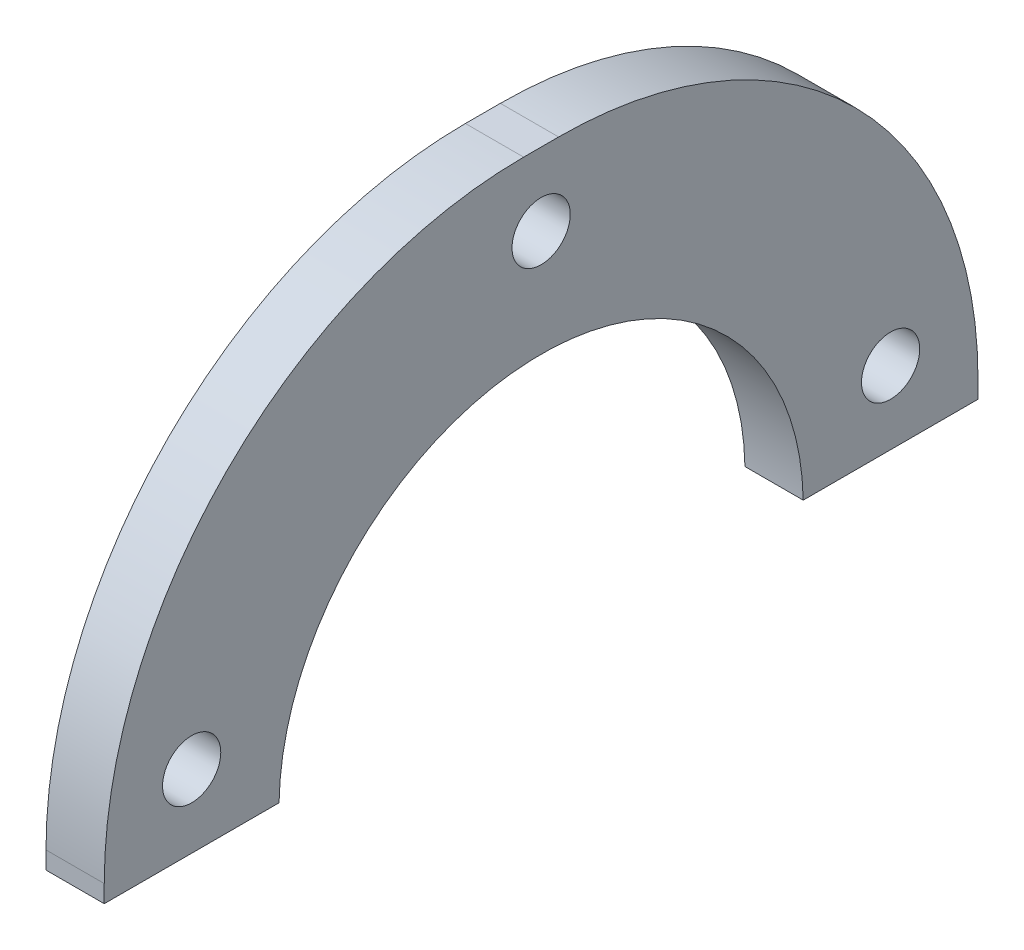
from build123d import *

# Parameters (mm, degrees)
SKETCH1_W                        = 47.625
SKETCH1_H                        = 23.8125
BOSS_EXTRUDE1_DEPTH              = 3.175
SKETCH2_R                        = 14.2875
CUT_EXTRUDE1_DEPTH               = 27.811836385
F_1_8_0_125_DIAMETER_HOLE1_D     = 3.175
F_1_8_0_125_DIAMETER_HOLE1_DEPTH = 19.001994
F_1_8_0_125_DIAMETER_HOLE1_TIP   = 0.953866233
FILLET1_R                        = 22.86


with BuildPart() as part:
    # Sketch1 → Boss-Extrude1 (new body)
    with BuildSketch(Plane(origin=(0, 0, 0), x_dir=(0, 0, -1), z_dir=(1, 0, 0))):
        Rectangle(SKETCH1_W, SKETCH1_H)
    extrude(amount=BOSS_EXTRUDE1_DEPTH)

    # Sketch2 → Cut-Extrude1 (cut, through all)
    with BuildSketch(Plane(origin=(3.175, 0, 0), x_dir=(0, 0, -1), z_dir=(1, 0, 0))):
        with Locations((0, -12.16025)):
            Circle(SKETCH2_R)
    extrude(amount=-CUT_EXTRUDE1_DEPTH, mode=Mode.SUBTRACT)

    # 1/8 (0.125) Diameter Hole1
    with Locations(Plane(origin=(3.175, 0, 0), x_dir=(0, 0, -1), z_dir=(1, 0, 0))):
        with Locations((-19.048871022, -7.9375), (0, 7.9375), (19.048871022, -7.9375)):
            Hole(F_1_8_0_125_DIAMETER_HOLE1_D / 2, depth=F_1_8_0_125_DIAMETER_HOLE1_DEPTH)
            with Locations((0, 0, -(F_1_8_0_125_DIAMETER_HOLE1_DEPTH + F_1_8_0_125_DIAMETER_HOLE1_TIP / 2))):  # 118° drill point
                Cone(0, F_1_8_0_125_DIAMETER_HOLE1_D / 2, F_1_8_0_125_DIAMETER_HOLE1_TIP, mode=Mode.SUBTRACT)

    # Fillet1
    fillet1_edges = [part.edges().sort_by_distance(p)[0] for p in [
        (1.5875, 11.90625, 23.8125),
        (1.5875, 11.90625, -23.8125),
    ]]
    fillet(fillet1_edges, radius=FILLET1_R)


solid = part.part
